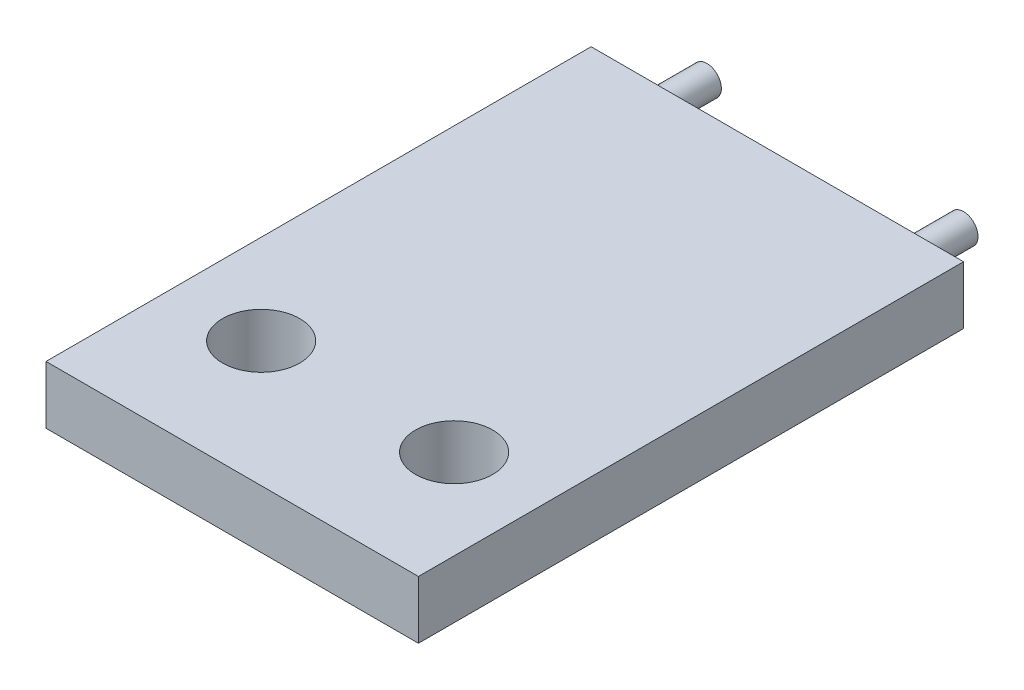
from build123d import *

# Parameters (mm, degrees)
SKETCH1_W           = 49.022
SKETCH1_H           = 101.6
BOSS_EXTRUDE1_DEPTH = 7.62
SKETCH2_R           = 5.08
CUT_EXTRUDE1_DEPTH  = 7.62
SKETCH4_W           = 49.022
SKETCH4_H           = 29.845
CUT_EXTRUDE2_DEPTH  = 57.916548745
SKETCH5_R           = 1.905
CUT_EXTRUDE3_DEPTH  = 17.78
BOSS_EXTRUDE3_START = 25.4
SKETCH6_R           = 1.905
BOSS_EXTRUDE3_DEPTH = 25.4


with BuildPart() as part:
    # Sketch1 → Boss-Extrude1 (new body)
    with BuildSketch(Plane(origin=(0, 0, 0), x_dir=(1, 0, 0), z_dir=(0, 1, 0))):
        Rectangle(SKETCH1_W, SKETCH1_H)
    extrude(amount=BOSS_EXTRUDE1_DEPTH)

    # Sketch2 → Cut-Extrude1 (cut)
    with BuildSketch(Plane(origin=(0, 7.62, 0), x_dir=(1, 0, 0), z_dir=(0, 1, 0))):
        with Locations(Location((12.7, -34.29, 0), (0, 0, 270))):
            Circle(SKETCH2_R)
        with Locations(Location((-12.7, -34.29, 0), (0, 0, 270))):
            Circle(SKETCH2_R)
    extrude(amount=-CUT_EXTRUDE1_DEPTH, mode=Mode.SUBTRACT)

    # Sketch4 → Cut-Extrude2 (cut, through all)
    with BuildSketch(Plane(origin=(0, 7.62, 0), x_dir=(1, 0, 0), z_dir=(0, 1, 0))):
        with Locations((0, 35.8775)):
            Rectangle(SKETCH4_W, SKETCH4_H)
    extrude(amount=-CUT_EXTRUDE2_DEPTH, mode=Mode.SUBTRACT)

    # Sketch5 → Cut-Extrude3 (cut)
    with BuildSketch(Plane(origin=(0, 0, -20.955), x_dir=(-1, 0, 0), z_dir=(0, 0, -1))):
        with Locations((-16.891, 3.81)):
            Circle(SKETCH5_R)
        with Locations((-7.62, 3.81)):
            Circle(SKETCH5_R)
        with Locations((7.62, 3.81)):
            Circle(SKETCH5_R)
        with Locations((16.891, 3.81)):
            Circle(SKETCH5_R)
    extrude(amount=-CUT_EXTRUDE3_DEPTH, mode=Mode.SUBTRACT)

    # Sketch6 → Boss-Extrude3 (add)
    with BuildSketch(Plane(origin=(0, 0, -3.175), x_dir=(-1, 0, 0), z_dir=(0, 0, -1)).offset(BOSS_EXTRUDE3_START)):
        with Locations((-16.891, 3.81)):
            Circle(SKETCH6_R)
        with Locations((16.891, 3.81)):
            Circle(SKETCH6_R)
    extrude(amount=-BOSS_EXTRUDE3_DEPTH)


solid = part.part
